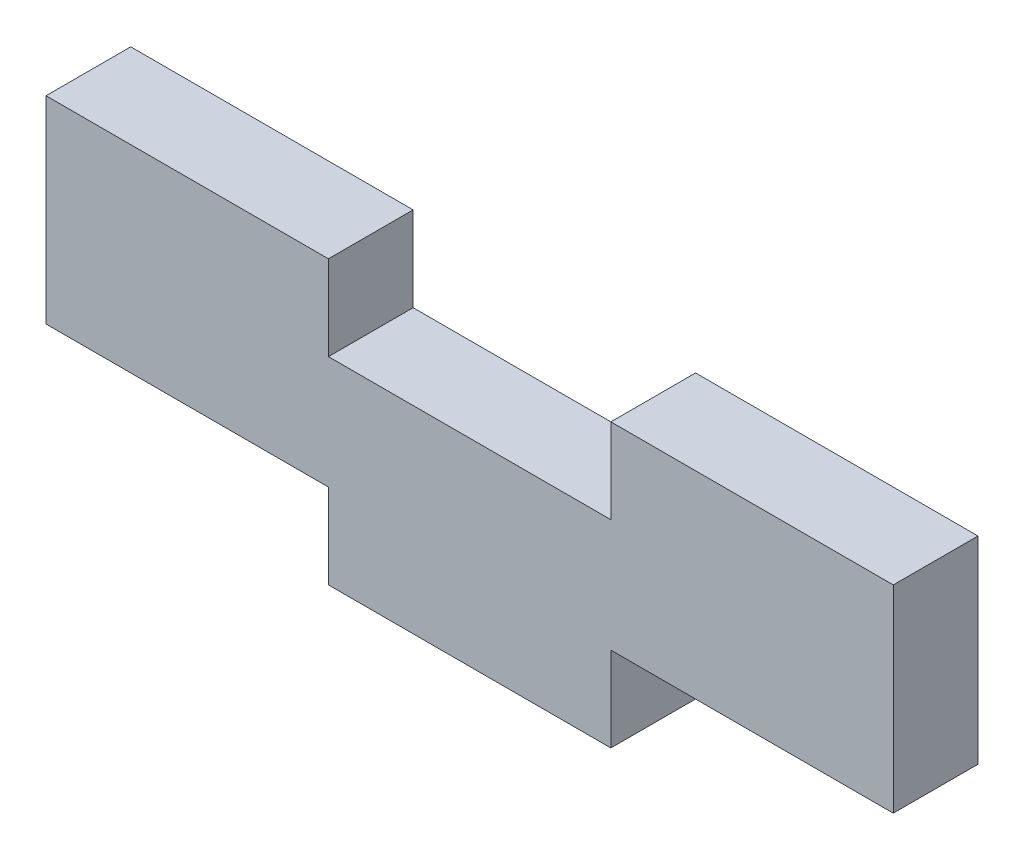
from build123d import *

# Parameters (mm, degrees)
BOSS_EXTRUDE1_DEPTH = 3


with BuildPart() as part:
    # Sketch1 → Boss-Extrude1 (new body)
    with BuildSketch(Plane.XY):
        Polygon((0, 0), (-10, 0), (-10, -3), (-20, -3), (-20, 0), (-30, 0), (-30, 7), (-20, 7), (-20, 4), (-10, 4), (-10, 7), (0, 7), align=None)
    extrude(amount=BOSS_EXTRUDE1_DEPTH)


solid = part.part
